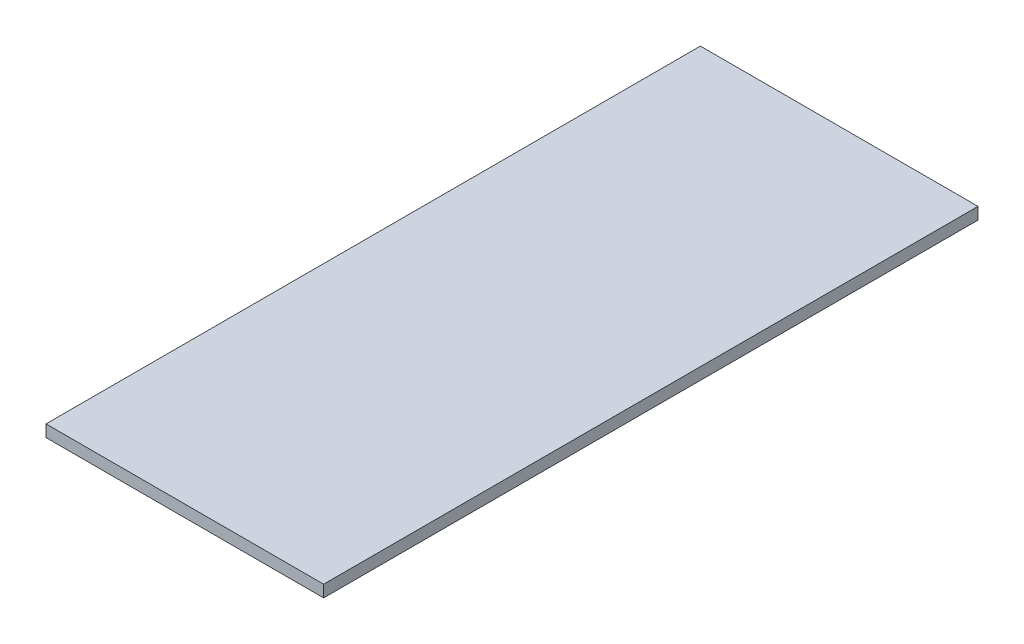
from build123d import *

# Parameters (mm, degrees)
SKETCH1_W           = 7
SKETCH1_H           = 16.5
BOSS_EXTRUDE1_DEPTH = 0.15


with BuildPart() as part:
    # Sketch1 → Boss-Extrude1 (new, symmetric)
    with BuildSketch(Plane(origin=(0, 0, 0), x_dir=(1, 0, 0), z_dir=(0, 1, 0))):
        Rectangle(SKETCH1_W, SKETCH1_H)
    extrude(amount=BOSS_EXTRUDE1_DEPTH, both=True)


solid = part.part
